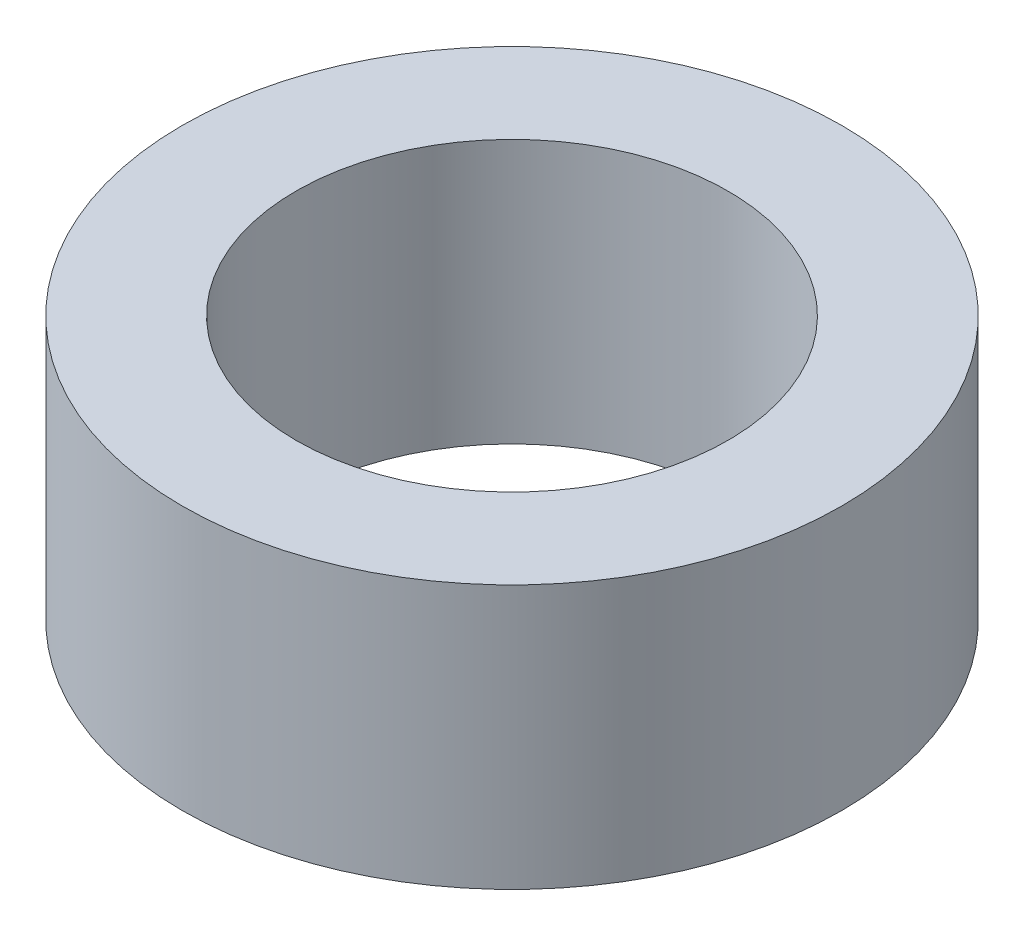
from build123d import *

# Parameters (mm, degrees)
SKETCH1_R           = 3.96875
SKETCH1_R_2         = 2.6
BOSS_EXTRUDE1_DEPTH = 3.175


with BuildPart() as part:
    # Sketch1 → Boss-Extrude1 (new body)
    with BuildSketch(Plane(origin=(0, 0, 0), x_dir=(1, 0, 0), z_dir=(0, 1, 0))):
        with Locations(Location((0, 0, 0), (0, 0, 270))):
            Circle(SKETCH1_R)
        with Locations(Location((0, 0, 0), (0, 0, 270))):
            Circle(SKETCH1_R_2, mode=Mode.SUBTRACT)
    extrude(amount=BOSS_EXTRUDE1_DEPTH)


solid = part.part
